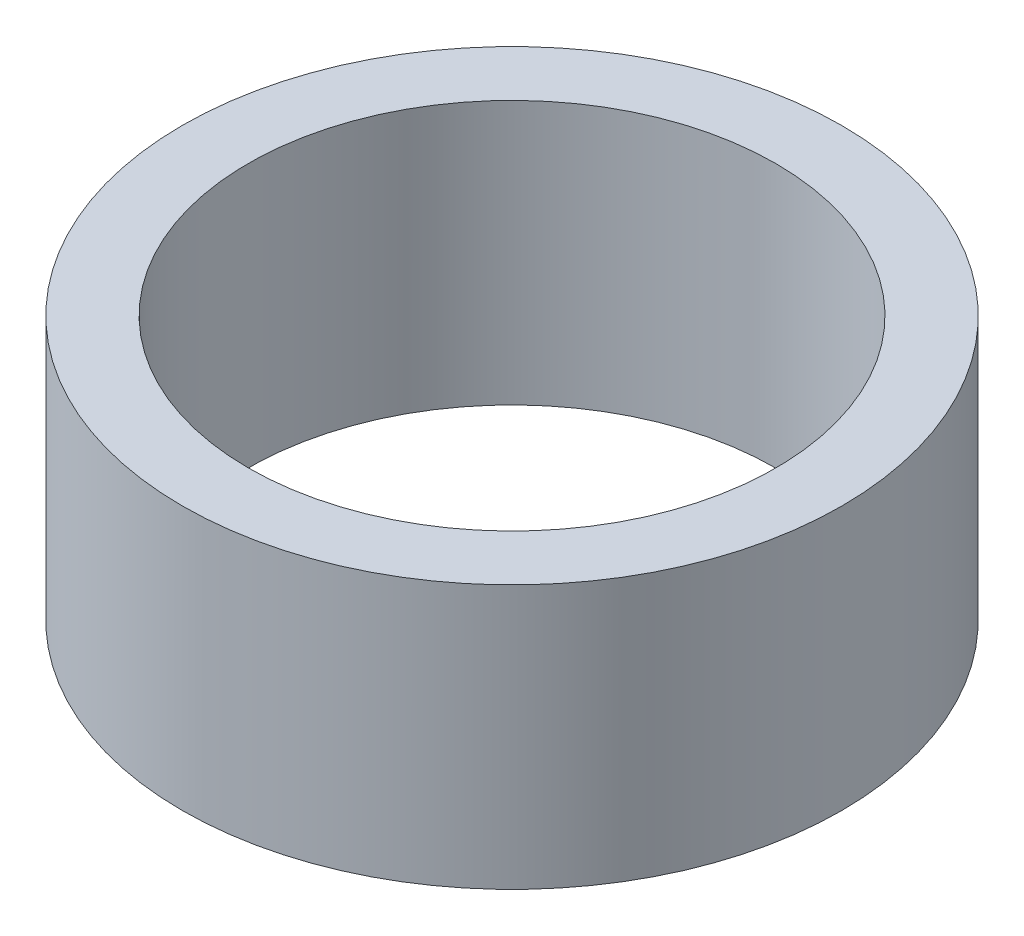
from build123d import *

# Parameters (mm, degrees)
ESQUISSE1_R          = 5
ESQUISSE1_R_2        = 4
BASE_EXTRUSION_DEPTH = 4


with BuildPart() as part:
    # Esquisse1 → Base-Extrusion (new body)
    with BuildSketch(Plane(origin=(0.078769876, 608.680167021, -0.119800831), x_dir=(0.9999999916264037, -0.00012941094413665422, 0), z_dir=(-0.0001294109416300697, -0.9999999722572189, 0.00019682065317602586))):
        with Locations(Location((2143.706121952, 669.110625298, 0), (0, 0, 90.000001459))):
            Circle(ESQUISSE1_R)
        with Locations(Location((2143.706121952, 669.110625298, 0), (0, 0, 90.000001459))):
            Circle(ESQUISSE1_R_2, mode=Mode.SUBTRACT)
    extrude(amount=-BASE_EXTRUSION_DEPTH)


solid = part.part
